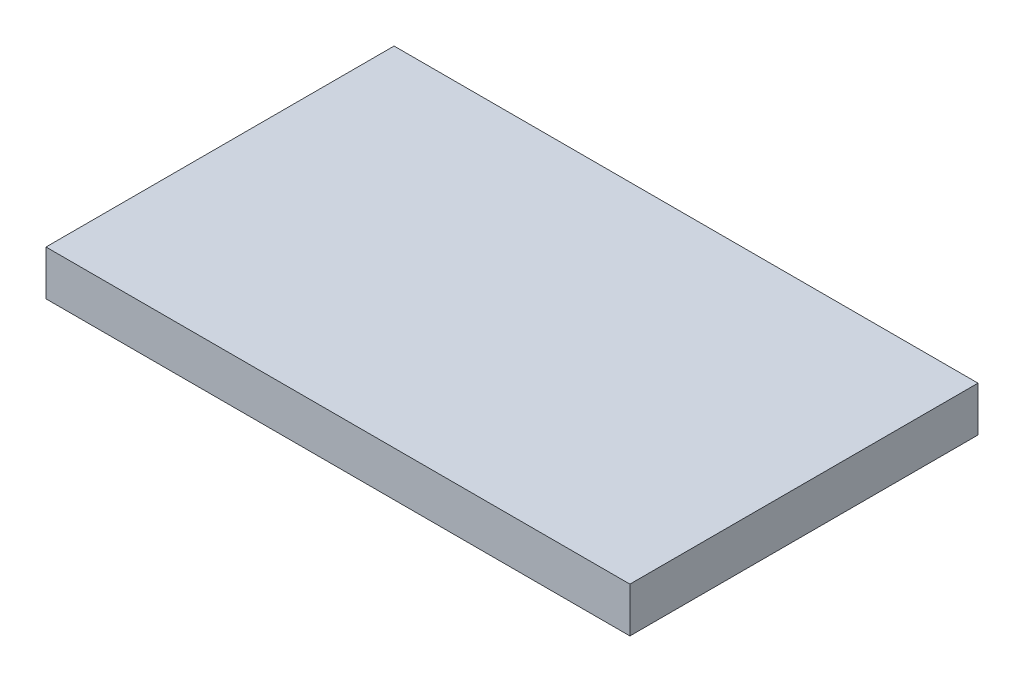
from build123d import *

# Parameters (mm, degrees)
SKETCH1_W           = 26
SKETCH1_H           = 15.5
BOSS_EXTRUDE1_DEPTH = 2


with BuildPart() as part:
    # Sketch1 → Boss-Extrude1 (new body)
    with BuildSketch(Plane(origin=(0, 0, 0), x_dir=(1, 0, 0), z_dir=(0, 1, 0))):
        Rectangle(SKETCH1_W, SKETCH1_H)
    extrude(amount=BOSS_EXTRUDE1_DEPTH)


solid = part.part
